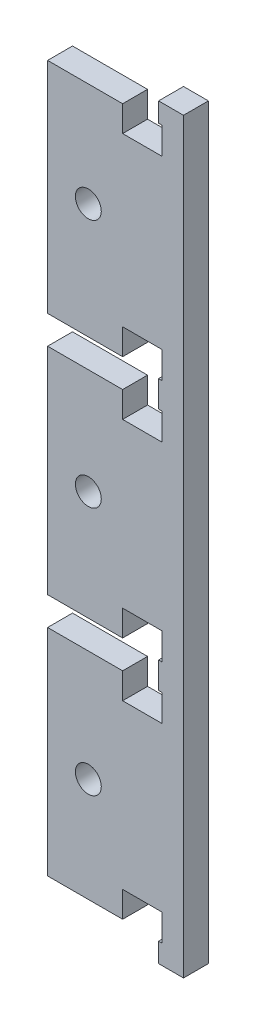
from build123d import *

# Parameters (mm, degrees)
SKETCH2_W           = 40.132
SKETCH2_H           = 190.436
BOSS_EXTRUDE1_DEPTH = 6.35
SKETCH3_R           = 3.3
CUT_EXTRUDE1_DEPTH  = 478.183864302
SKETCH4_W           = 10.033
SKETCH4_H           = 6.858
CUT_EXTRUDE2_DEPTH  = 474.191260281


with BuildPart() as part:
    # Sketch2 → Boss-Extrude1 (new body)
    with BuildSketch(Plane.XY):
        with Locations((-328.134441571, 231.003658294)):
            Rectangle(SKETCH2_W, SKETCH2_H)
    extrude(amount=BOSS_EXTRUDE1_DEPTH)

    # Sketch3 → Cut-Extrude1 (cut, through all)
    with BuildSketch(Plane.XY.offset(6.35)):
        Polygon((-314.418441571, 195.840658294), (-314.418441571, 203.079658294), (-342.708441633, 203.079658294), (-342.708441633, 257.927658294), (-314.418441571, 257.927658294), (-314.418441571, 265.166658294), (-342.708441633, 265.166658294), (-342.708441633, 321.014658294), (-314.418441571, 321.014658294), (-314.418441571, 326.221658294), (-348.200441571, 326.221658294), (-348.200441571, 135.785658294), (-314.418441571, 135.785658294), (-314.418441571, 140.992658294), (-342.708441633, 140.992658294), (-342.708441633, 195.840658294), align=None)
        with Locations((-332.325441571, 294.535658294)):
            Circle(SKETCH3_R)
        with Locations((-332.325441571, 231.035658294)):
            Circle(SKETCH3_R)
        with Locations((-332.325441571, 167.535658294)):
            Circle(SKETCH3_R)
    extrude(amount=-CUT_EXTRUDE1_DEPTH, mode=Mode.SUBTRACT)

    # Sketch4 → Cut-Extrude2 (cut, through all)
    with BuildSketch(Plane.XY.offset(6.35)):
        with Locations((-318.564971808, 144.167658294)):
            Rectangle(SKETCH4_W, SKETCH4_H)
        with Locations((-318.564971808, 192.656258294)):
            Rectangle(SKETCH4_W, SKETCH4_H)
        with Locations((-318.564971808, 206.245258294)):
            Rectangle(SKETCH4_W, SKETCH4_H)
        with Locations((-318.564971808, 254.759258294)):
            Rectangle(SKETCH4_W, SKETCH4_H)
        with Locations((-318.564971808, 268.348258294)):
            Rectangle(SKETCH4_W, SKETCH4_H)
        with Locations((-318.564971808, 317.852858294)):
            Rectangle(SKETCH4_W, SKETCH4_H)
    extrude(amount=-CUT_EXTRUDE2_DEPTH, mode=Mode.SUBTRACT)


solid = part.part
